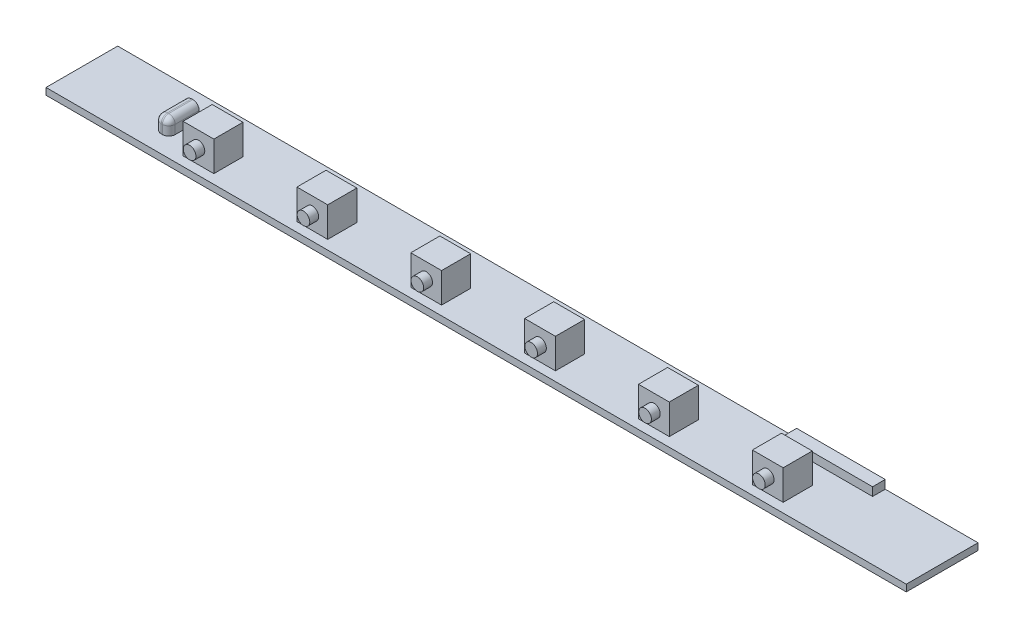
from build123d import *

# Parameters (mm, degrees)
SKETCH1_W           = 204
SKETCH1_H           = 17
BOSS_EXTRUDE1_DEPTH = 1.6
SKETCH2_W           = 7.3
SKETCH2_H           = 6.9
BOSS_EXTRUDE2_DEPTH = 7.1
SKETCH6_R           = 1.5
BOSS_EXTRUDE6_DEPTH = 2.1
SKETCH4_W           = 3.3
SKETCH4_H           = 7.2
BOSS_EXTRUDE4_DEPTH = 3.6
SKETCH5_W           = 21
SKETCH5_H           = 3
BOSS_EXTRUDE5_DEPTH = 2
LPATTERN1_COUNT     = 6
LPATTERN1_PITCH     = 27
FILLET1_R           = 1.5


with BuildPart() as part:
    # Sketch1 → Boss-Extrude1 (new body)
    with BuildSketch(Plane(origin=(0, 0, 0), x_dir=(1, 0, 0), z_dir=(0, 1, 0))):
        with Locations((102, 8.5)):
            Rectangle(SKETCH1_W, SKETCH1_H)
    extrude(amount=BOSS_EXTRUDE1_DEPTH)

    # Sketch2 → Boss-Extrude2 (add)
    with BuildSketch(Plane(origin=(0, 1.6, 0), x_dir=(1, 0, 0), z_dir=(0, 1, 0))):
        with Locations((33.95, 5.65)):
            Rectangle(SKETCH2_W, SKETCH2_H)
    boss_extrude2 = extrude(amount=BOSS_EXTRUDE2_DEPTH)

    # Sketch6 → Boss-Extrude6 (add)
    with BuildSketch(Plane.XY.offset(-2.2)):
        with Locations(Location((33.95, 5.15, 0), (0, 0, 180))):
            Circle(SKETCH6_R)
    boss_extrude6 = extrude(amount=BOSS_EXTRUDE6_DEPTH)

    # Sketch4 → Boss-Extrude4 (add)
    with BuildSketch(Plane(origin=(0, 1.6, 0), x_dir=(1, 0, 0), z_dir=(0, 1, 0))):
        with Locations((23.350594588, 7.718433613)):
            Rectangle(SKETCH4_W, SKETCH4_H)
    extrude(amount=BOSS_EXTRUDE4_DEPTH)

    # Sketch5 → Boss-Extrude5 (add)
    with BuildSketch(Plane(origin=(0, 1.6, 0), x_dir=(1, 0, 0), z_dir=(0, 1, 0))):
        with Locations((171.5, 15.5)):
            Rectangle(SKETCH5_W, SKETCH5_H)
    extrude(amount=BOSS_EXTRUDE5_DEPTH)

    # LPattern1: Boss-Extrude2, Boss-Extrude6 ×6
    with Locations(*[(i * LPATTERN1_PITCH, 0, 0) for i in range(1, LPATTERN1_COUNT)]):
        add(boss_extrude2)
        add(boss_extrude6)

    # Fillet1
    fillet1_edges = [part.edges().sort_by_distance(p)[0] for p in [
        (21.700594588, 3.4, -4.118433613),
        (25.000594588, 3.4, -4.118433613),
        (21.700594588, 5.2, -7.718433613),
        (23.350594588, 5.2, -4.118433613),
        (25.000594588, 5.2, -7.718433613),
    ]]
    fillet(fillet1_edges, radius=FILLET1_R)


solid = part.part
